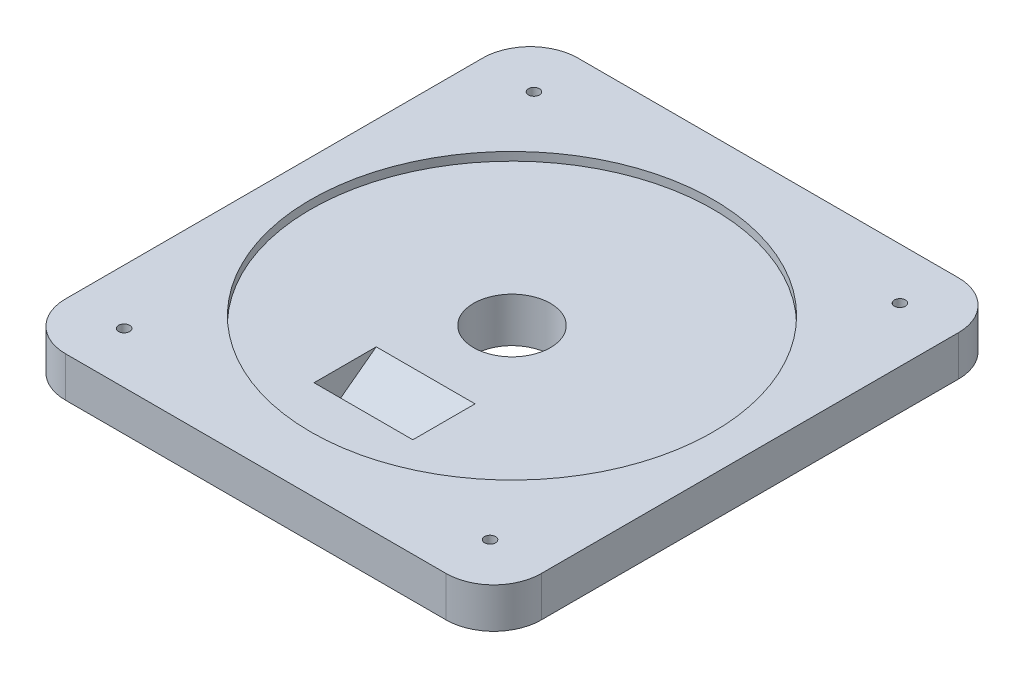
from build123d import *

# Parameters (mm, degrees)
SKETCH2_W               = 165.1
SKETCH2_H               = 177.8
BOSS_EXTRUDE1_DEPTH     = 13.97
FILLET1_R               = 16.51
SKETCH3_R               = 1.905
CUT_EXTRUDE1_DEPTH      = 123.118276273
BOSS_EXTRUDE2_DEPTH     = 4.445
CUT_EXTRUDE3_DEPTH      = 123.118276273
CUT_EXTRUDE3_DEPTH_BACK = 123.118276273
SKETCH4_R               = 13.335
SKETCH9_R               = 69.85
CUT_EXTRUDE4_DEPTH      = 2.921
CUT_EXTRUDE5_DEPTH      = 17.145


with BuildPart() as part:
    # Sketch2 → Boss-Extrude1 (new body)
    with BuildSketch(Plane(origin=(0, 0, 0), x_dir=(1, 0, 0), z_dir=(0, 1, 0))):
        Rectangle(SKETCH2_W, SKETCH2_H)
    extrude(amount=BOSS_EXTRUDE1_DEPTH)

    # Fillet1
    fillet1_edges = [part.edges().sort_by_distance(p)[0] for p in [
        (82.55, 6.985, 88.9),
        (-82.55, 6.985, 88.9),
        (-82.55, 6.985, -88.9),
        (82.55, 6.985, -88.9),
    ]]
    fillet(fillet1_edges, radius=FILLET1_R)

    # Sketch3 → Cut-Extrude1 (cut, through all)
    with BuildSketch(Plane.XZ):
        with Locations(Location((-63.5, 71.12, 0), (0, 0, 270))):
            Circle(SKETCH3_R)
        with Locations(Location((63.5, 71.12, 0), (0, 0, 270))):
            Circle(SKETCH3_R)
        with Locations(Location((-63.5, -71.12, 0), (0, 0, 270))):
            Circle(SKETCH3_R)
        with Locations(Location((63.5, -71.12, 0), (0, 0, 270))):
            Circle(SKETCH3_R)
    extrude(amount=-CUT_EXTRUDE1_DEPTH, mode=Mode.SUBTRACT)

    # Sketch5 → Boss-Extrude2 (add)
    with BuildSketch(Plane.XZ):
        with BuildLine():
            Line((-49.252427351, 49.53), (49.252427351, 49.53))
            ThreePointArc((49.252427351, 49.53), (0, -69.85), (-49.252427351, 49.53))
        make_face()
    extrude(amount=BOSS_EXTRUDE2_DEPTH)

    # Sketch4 → Cut-Extrude3 (cut, two sides: drawn at the far end of the back side and taken through both)
    with BuildSketch(Plane.XZ.offset(-CUT_EXTRUDE3_DEPTH_BACK)):
        with Locations(Location((0, 0, 0), (0, 0, 270))):
            Circle(SKETCH4_R)
    extrude(amount=CUT_EXTRUDE3_DEPTH + CUT_EXTRUDE3_DEPTH_BACK, mode=Mode.SUBTRACT)

    # Sketch9 → Cut-Extrude4 (cut)
    with BuildSketch(Plane(origin=(0, 13.97, 0), x_dir=(1, 0, 0), z_dir=(0, 1, 0))):
        with Locations(Location((0, 0, 0), (0, 0, 270))):
            Circle(SKETCH9_R)
    extrude(amount=-CUT_EXTRUDE4_DEPTH, mode=Mode.SUBTRACT)

    # Sketch15 → Cut-Extrude5 (cut, symmetric)
    with BuildSketch(Plane(origin=(0, 0, 0), x_dir=(0, 0, -1), z_dir=(1, 0, 0))):
        Polygon((-51.562, 11.049), (-51.562, -5.08), (-29.972, 11.049), align=None)
    extrude(amount=CUT_EXTRUDE5_DEPTH, both=True, mode=Mode.SUBTRACT)


solid = part.part
